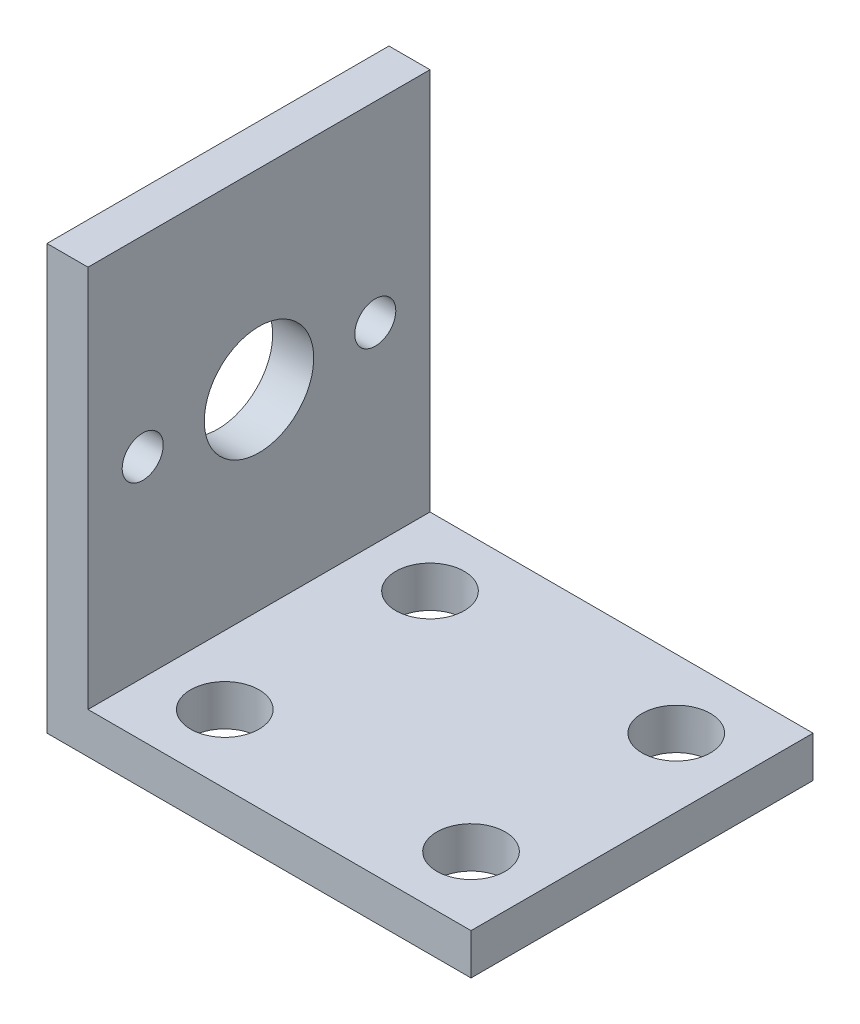
from build123d import *

# Parameters (mm, degrees)
BOSS_EXTRUDE1_DEPTH = 25
SKETCH2_R           = 1.5
SKETCH2_R_2         = 4
CUT_EXTRUDE1_DEPTH  = 49.682645779
CUT_EXTRUDE2_REACH  = 50.683
SKETCH3_R           = 2.5


with BuildPart() as part:
    # Sketch1 → Boss-Extrude1 (new body)
    with BuildSketch(Plane.XY):
        Polygon((0, 31), (0, 0), (31, 0), (31, 3), (3, 3), (3, 31), align=None)
    extrude(amount=BOSS_EXTRUDE1_DEPTH)

    # Sketch2 → Cut-Extrude1 (cut, through all)
    with BuildSketch(Plane(origin=(3, 0, 0), x_dir=(0, 0, -1), z_dir=(1, 0, 0))):
        with Locations(Location((-21, 17, 0), (0, 0, 90))):
            Circle(SKETCH2_R)
        with Locations(Location((-12.5, 17, 0), (0, 0, 90))):
            Circle(SKETCH2_R_2)
        with Locations(Location((-4, 17, 0), (0, 0, 90))):
            Circle(SKETCH2_R)
    extrude(amount=-CUT_EXTRUDE1_DEPTH, mode=Mode.SUBTRACT)

    # Sketch3 → Cut-Extrude2 (cut, up to next)
    with BuildSketch(Plane(origin=(0, 3, 0), x_dir=(1, 0, 0), z_dir=(0, 1, 0)), mode=Mode.PRIVATE) as cut_extrude2_sk1:
        with Locations(Location((8, -5, 0), (0, 0, 180))):
            Circle(SKETCH3_R)
    cut_extrude2_tool1 = extrude(cut_extrude2_sk1.sketch, amount=-CUT_EXTRUDE2_REACH, mode=Mode.PRIVATE) & part.part
    # Sketch3 → Cut-Extrude2 (cut, up to next)
    with BuildSketch(Plane(origin=(0, 3, 0), x_dir=(1, 0, 0), z_dir=(0, 1, 0)), mode=Mode.PRIVATE) as cut_extrude2_sk2:
        with Locations(Location((26, -5, 0), (0, 0, 180))):
            Circle(SKETCH3_R)
    cut_extrude2_tool2 = extrude(cut_extrude2_sk2.sketch, amount=-CUT_EXTRUDE2_REACH, mode=Mode.PRIVATE) & part.part
    # Sketch3 → Cut-Extrude2 (cut, up to next)
    with BuildSketch(Plane(origin=(0, 3, 0), x_dir=(1, 0, 0), z_dir=(0, 1, 0)), mode=Mode.PRIVATE) as cut_extrude2_sk3:
        with Locations(Location((26, -20, 0), (0, 0, 180))):
            Circle(SKETCH3_R)
    cut_extrude2_tool3 = extrude(cut_extrude2_sk3.sketch, amount=-CUT_EXTRUDE2_REACH, mode=Mode.PRIVATE) & part.part
    # Sketch3 → Cut-Extrude2 (cut, up to next)
    with BuildSketch(Plane(origin=(0, 3, 0), x_dir=(1, 0, 0), z_dir=(0, 1, 0)), mode=Mode.PRIVATE) as cut_extrude2_sk4:
        with Locations(Location((8, -20, 0), (0, 0, 180))):
            Circle(SKETCH3_R)
    cut_extrude2_tool4 = extrude(cut_extrude2_sk4.sketch, amount=-CUT_EXTRUDE2_REACH, mode=Mode.PRIVATE) & part.part
    add(cut_extrude2_tool1.solids().sort_by_distance((8, 3, 5))[0], mode=Mode.SUBTRACT)
    add(cut_extrude2_tool2.solids().sort_by_distance((26, 3, 5))[0], mode=Mode.SUBTRACT)
    add(cut_extrude2_tool3.solids().sort_by_distance((26, 3, 20))[0], mode=Mode.SUBTRACT)
    add(cut_extrude2_tool4.solids().sort_by_distance((8, 3, 20))[0], mode=Mode.SUBTRACT)


solid = part.part
